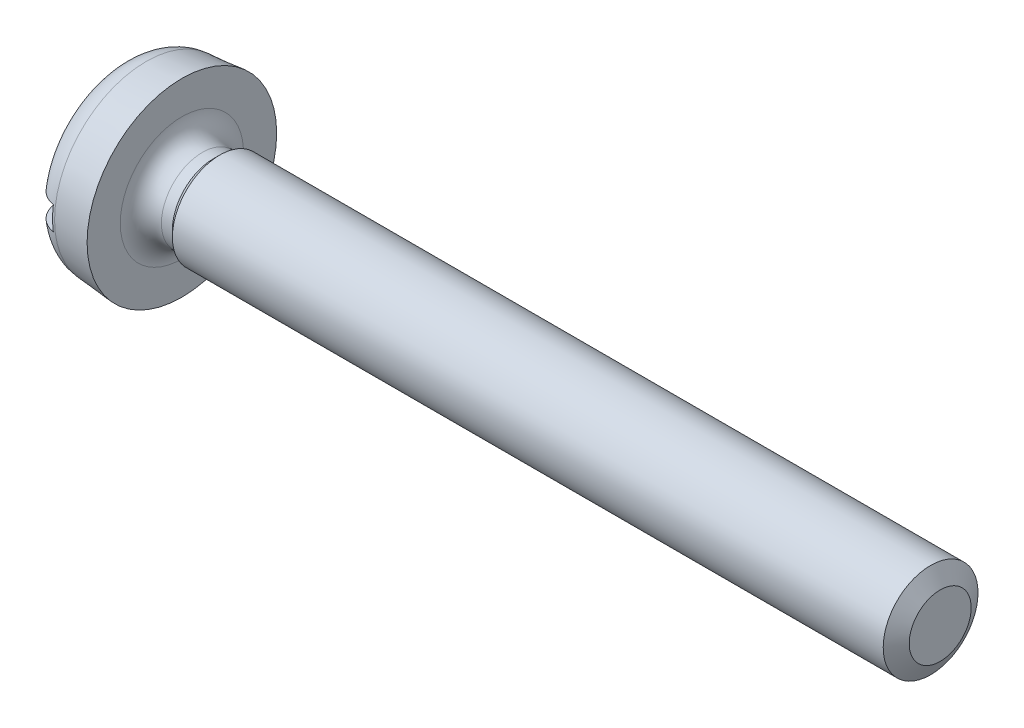
from build123d import *

# Parameters (mm, degrees)
SKETCH_4_W          = 0.5
SKETCH_4_H          = 0.5
CUT_EXTRUDE_1_DEPTH = 50


with BuildPart() as part:
    # 草图3 → Revolve 928 (revolve)
    with BuildSketch(Plane.XY, mode=Mode.PRIVATE) as revolve_928_sk:
        with BuildLine():
            Line((0, 0), (17.3, 0))
            Line((17.3, 0), (17.3, 1))
            Line((17.3, 1), (2.1, 1))
            Line((2.1, 1), (1.966, 0.866))
            Line((1.966, 0.866), (1.734, 0.866))
            ThreePointArc((1.734, 0.866), (1.427115657, 0.993115657), (1.3, 1.3))
            Line((1.3, 1.3), (1.3, 2))
            Line((1.3, 2), (0.547706554, 1.934182852))
            ThreePointArc((0.547706554, 1.934182852), (0.157633598, 1.741820158), (0, 1.336466033))
            Line((0, 1.336466033), (0, 0))
        make_face()
    revolve(revolve_928_sk.sketch.rotate(Axis((-2.477021524, 0, 0), (1, 0, 0)), 90), axis=Axis((-2.477021524, 0, 0), (1, 0, 0)))

    # 草图4 → 切除-拉伸1 (cut, symmetric)
    with BuildSketch(Plane.XY):
        with Locations((0.25, 0)):
            Rectangle(SKETCH_4_W, SKETCH_4_H)
    extrude(amount=CUT_EXTRUDE_1_DEPTH, both=True, mode=Mode.SUBTRACT)

    # 草图5 → 切除-旋转1 (revolve, cut)
    with BuildSketch(Plane.XY, mode=Mode.PRIVATE) as cut_revolve_1_sk:
        Polygon((17.097833598, 1), (17.497833598, 1), (17.3, 0.6536), align=None)
    revolve(cut_revolve_1_sk.sketch.rotate(Axis((6.174994867, 0, 0), (-1, 0, 0)), 270), axis=Axis((6.174994867, 0, 0), (-1, 0, 0)), mode=Mode.SUBTRACT)


solid = part.part
